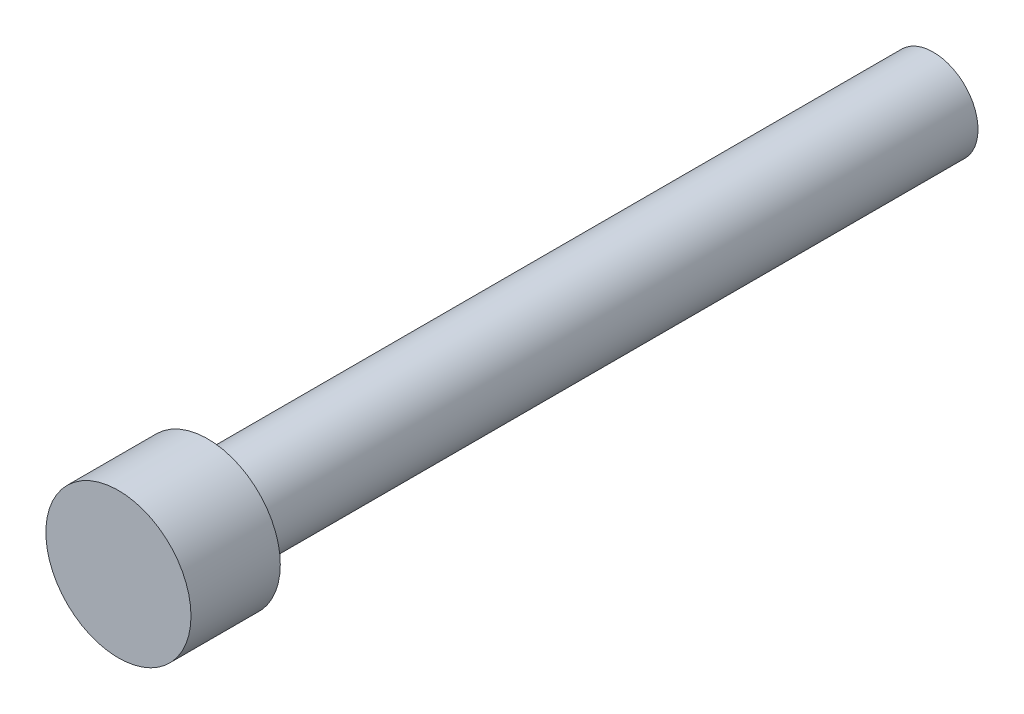
from build123d import *

# Parameters (mm, degrees)
SKETCH_1_R                      = 4
SHANK_SIMPLIFIED_DEPTH          = 65
SKETCH_2_R                      = 6.5
PURCHASED_HEAD_SIMPLIFIED_DEPTH = 8


with BuildPart() as part:
    # 草图1 → Shank_simplified (new body)
    with BuildSketch(Plane.XY):
        Circle(SKETCH_1_R)
    extrude(amount=SHANK_SIMPLIFIED_DEPTH)

    # 草图2 → Purchased_head_simplified (add)
    with BuildSketch(Plane.XY.offset(65)):
        Circle(SKETCH_2_R)
    extrude(amount=PURCHASED_HEAD_SIMPLIFIED_DEPTH)


solid = part.part
